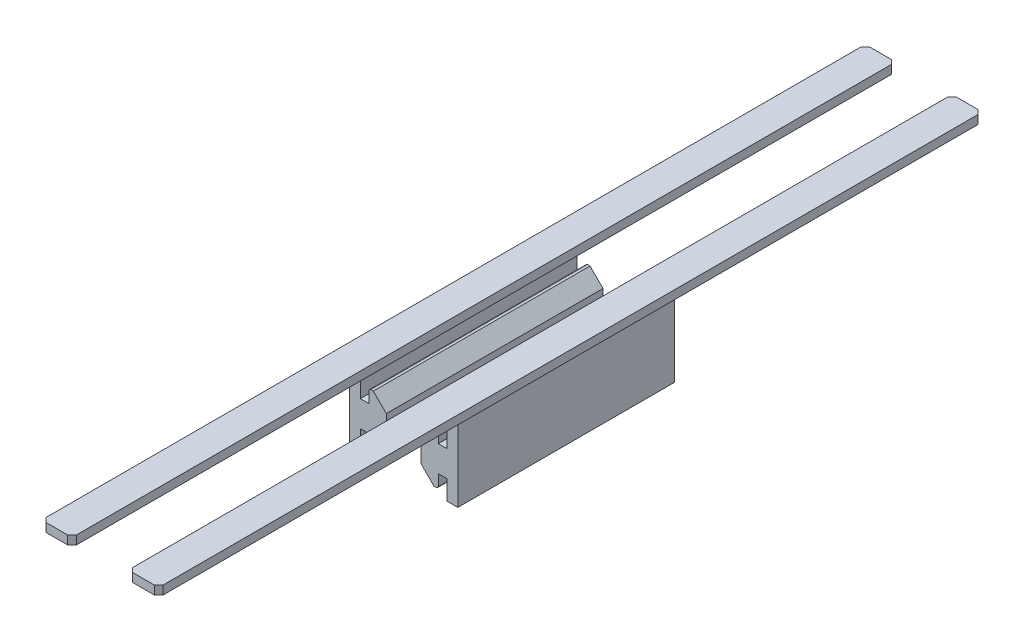
from build123d import *

# Parameters (mm, degrees)
ESTRUSIONE_ESTRUSIONE1_DEPTH = 70
ESTRUSIONE_ESTRUSIONE2_DEPTH = 70
ESTRUSIONE_ESTRUSIONE3_DEPTH = 70
ESTRUSIONE_ESTRUSIONE4_DEPTH = 70
SCHIZZO4_W                   = 25
SCHIZZO4_H                   = 2
ESTRUSIONE_ESTRUSIONE5_DEPTH = 70
SCHIZZO6_W                   = 7
SCHIZZO6_H                   = 70
ESTRUSIONE_ESTRUSIONE6_DEPTH = 2
SCHIZZO6_3_W                 = 13
SCHIZZO6_3_H                 = 70
TAGLIO_ESTRUSIONE1_DEPTH     = 2
RACCORDO1_R                  = 0.5
RACCORDO2_R                  = 0.5
SCHIZZO7_W                   = 7
SCHIZZO7_H                   = 2
ESTRUSIONE_ESTRUSIONE8_DEPTH = 60
SCHIZZO8_W                   = 7
SCHIZZO8_H                   = 2
ESTRUSIONE_ESTRUSIONE9_DEPTH = 60
SCHIZZO9_W                   = 10
SCHIZZO9_H                   = 17.5
TAGLIO_ESTRUSIONE2_DEPTH     = 60
SMUSSO1_SIZE                 = 1
SMUSSO2_SIZE                 = 1


with BuildPart() as part:
    # Schizzo1 → Estrusione-Estrusione1 (new body)
    with BuildSketch(Plane.XY):
        Polygon((0, -3), (3, -6), (4, -6), (4, -3), (6, -3), (6, 3), (4, 3), (4, 6), (3, 6), (0, 3), align=None)
    extrude(amount=ESTRUSIONE_ESTRUSIONE1_DEPTH)

    # Schizzo2 → Estrusione-Estrusione2 (add)
    with BuildSketch(Plane.XY.offset(70)):
        Polygon((6, 3), (6, 12), (8.5, 12), (8.5, -7.5), (6, -7.5), (6, -3), (4, -3), (4, -6), (3, -6), (0, -3), (0, 3), (3, 6), (4, 6), (4, 3), align=None)
    extrude(amount=-ESTRUSIONE_ESTRUSIONE2_DEPTH)



with BuildPart() as body_2:
    # Schizzo1<3> → Estrusione-Estrusione3 (new body)
    with BuildSketch(Plane.XY):
        Polygon((-12, 6), (-12, 3), (-14, 3), (-14, -3), (-12, -3), (-12, -6), (-11, -6), (-8, -3), (-8, 3), (-11, 6), align=None)
    extrude(amount=ESTRUSIONE_ESTRUSIONE3_DEPTH)

    # Schizzo3 → Estrusione-Estrusione4 (add)
    with BuildSketch(Plane.XY.offset(70)):
        Polygon((-14, -3), (-14, -7.5), (-16.5, -7.5), (-16.5, 12), (-14, 12), (-14, 3), (-12, 3), (-12, 6), (-11, 6), (-8, 3), (-8, -3), (-11, -6), (-12, -6), (-12, -3), align=None)
    extrude(amount=-ESTRUSIONE_ESTRUSIONE4_DEPTH)


with BuildPart() as part_1:
    add(part.part)

    add(body_2.part)  # Estrusione-Estrusione5 merges body 2
    # Schizzo4 → Estrusione-Estrusione5 (add)
    with BuildSketch(Plane.XY.offset(70)):
        with Locations((-4, 11)):
            Rectangle(SCHIZZO4_W, SCHIZZO4_H)
    extrude(amount=-ESTRUSIONE_ESTRUSIONE5_DEPTH)

    # Schizzo6 → Estrusione-Estrusione6 (add)
    with BuildSketch(Plane(origin=(0, 12, 0), x_dir=(1, 0, 0), z_dir=(0, 1, 0))):
        with Locations((-14, -35)):
            Rectangle(SCHIZZO6_W, SCHIZZO6_H)
        with Locations((6, -35)):
            Rectangle(SCHIZZO6_W, SCHIZZO6_H)
    extrude(amount=-ESTRUSIONE_ESTRUSIONE6_DEPTH)

    # Schizzo6<3> → Taglio-Estrusione1 (cut)
    with BuildSketch(Plane(origin=(0, 12, 0), x_dir=(1, 0, 0), z_dir=(0, 1, 0))):
        with Locations((-4, -35)):
            Rectangle(SCHIZZO6_3_W, SCHIZZO6_3_H)
    extrude(amount=-TAGLIO_ESTRUSIONE1_DEPTH, mode=Mode.SUBTRACT)


with BuildPart() as taglio_estrusione1_piece_1:
    # of the separate pieces the step leaves, piece 1, a body of its own (taglio_estrusione1_pieces)
    add(part_1.part.solids().sort_by_distance((2.5, 12, 0))[0])

    # Raccordo1
    raccordo1_edges = [taglio_estrusione1_piece_1.edges().sort_by_distance(p)[0] for p in [
        (4, 6, 35),
        (4, -6, 35),
    ]]
    fillet(raccordo1_edges, radius=RACCORDO1_R)



with BuildPart() as taglio_estrusione1_piece_2:
    # of the separate pieces the step leaves, piece 2, a body of its own (taglio_estrusione1_pieces)
    add(part_1.part.solids().sort_by_distance((-12, 6, 0))[0])

    # Raccordo2
    raccordo2_edges = [taglio_estrusione1_piece_2.edges().sort_by_distance(p)[0] for p in [
        (-12, -6, 35),
        (-12, 6, 35),
    ]]
    fillet(raccordo2_edges, radius=RACCORDO2_R)


with BuildPart() as taglio_estrusione1_piece_1_1:
    add(taglio_estrusione1_piece_1.part)

    add(taglio_estrusione1_piece_2.part)  # Estrusione-Estrusione8 merges Taglio-Estrusione1 piece 2
    # Schizzo7 → Estrusione-Estrusione8 (add)
    with BuildSketch(Plane.XY.offset(70)):
        with Locations((-14, 11)):
            Rectangle(SCHIZZO7_W, SCHIZZO7_H)
        with Locations((6, 11)):
            Rectangle(SCHIZZO7_W, SCHIZZO7_H)
    extrude(amount=ESTRUSIONE_ESTRUSIONE8_DEPTH)

    # Schizzo8 → Estrusione-Estrusione9 (add)
    with BuildSketch(Plane(origin=(0, 0, 0), x_dir=(-1, 0, 0), z_dir=(0, 0, -1))):
        with Locations((-6, 11)):
            Rectangle(SCHIZZO8_W, SCHIZZO8_H)
        with Locations((14, 11)):
            Rectangle(SCHIZZO8_W, SCHIZZO8_H)
    extrude(amount=ESTRUSIONE_ESTRUSIONE9_DEPTH)

    # Schizzo9 → Taglio-Estrusione2 (cut)
    with BuildSketch(Plane(origin=(8.5, 0, 0), x_dir=(0, 0, -1), z_dir=(1, 0, 0))):
        with Locations((-65, 1.25)):
            Rectangle(SCHIZZO9_W, SCHIZZO9_H)
        with Locations((-5, 1.25)):
            Rectangle(SCHIZZO9_W, SCHIZZO9_H)
    extrude(amount=-TAGLIO_ESTRUSIONE2_DEPTH, mode=Mode.SUBTRACT)

    # Smusso1
    smusso1_edges = [taglio_estrusione1_piece_1_1.edges().sort_by_distance(p)[0] for p in [
        (-17.5, 11, -60),
        (-10.5, 11, -60),
        (-10.5, 11, 130),
        (-17.5, 11, 130),
    ]]
    chamfer(smusso1_edges, length=SMUSSO1_SIZE)

    # Smusso2
    smusso2_edges = [taglio_estrusione1_piece_1_1.edges().sort_by_distance(p)[0] for p in [
        (2.5, 11, 130),
        (9.5, 11, 130),
        (9.5, 11, -60),
        (2.5, 11, -60),
    ]]
    chamfer(smusso2_edges, length=SMUSSO2_SIZE)


solid = taglio_estrusione1_piece_1_1.part
